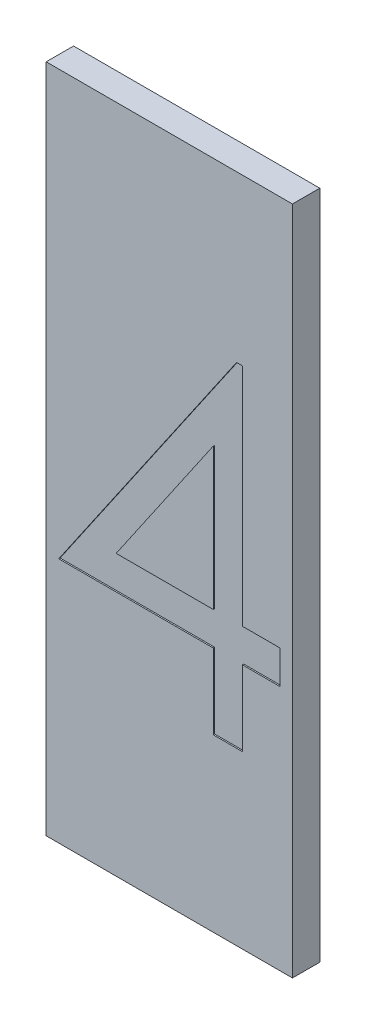
from build123d import *

# Parameters (mm, degrees)
SKETCH_1_W          = 18
SKETCH_1_H          = 49
EXTRUDE_1_DEPTH     = 2
CUT_EXTRUDE_1_DEPTH = 0.1


with BuildPart() as part:
    # ｽｹｯﾁ1 → ﾎﾞｽ - 押し出し1 (new body)
    with BuildSketch(Plane.XY):
        with Locations((9, 24.5)):
            Rectangle(SKETCH_1_W, SKETCH_1_H)
    extrude(amount=EXTRUDE_1_DEPTH)

    # ｽｹｯﾁ2 → ｶｯﾄ - 押し出し1 (cut)
    with BuildSketch(Plane.XY.offset(2)):
        Polygon((13.914475661, 36.923076923), (14.348557692, 36.923076923), (14.348557692, 20.4375), (17.096153846, 20.4375), (17.096153846, 17.995192308), (14.348557692, 17.995192308), (14.348557692, 12.5), (12.211538462, 12.5), (12.211538462, 17.995192308), (0.915865385, 17.995192308), align=None)
        Polygon((12.211538462, 20.4375), (12.211538462, 30.779146635), (5.113581731, 20.4375), align=None, mode=Mode.SUBTRACT)
    extrude(amount=-CUT_EXTRUDE_1_DEPTH, mode=Mode.SUBTRACT)


solid = part.part
